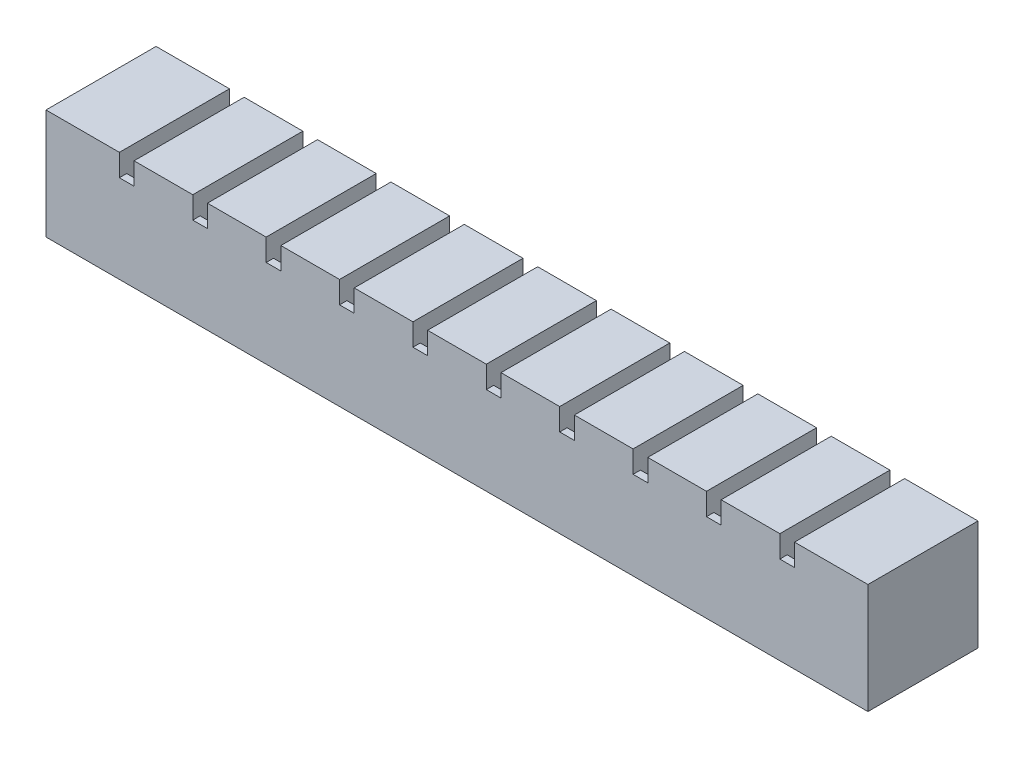
from build123d import *

# Parameters (mm, degrees)
SKETCH1_W                       = 8
SKETCH1_H                       = 15
FIRST_CHAMBER_BLOCK_DEPTH       = 15
SKETCH2_W                       = 6
SKETCH2_H                       = 11
FIRST_CHAMBER_CAVITY_DEPTH      = 13
SKETCH3_W                       = 15
SKETCH3_H                       = 3
CHAMBER_SPACER_DEPTH            = 2
PATTERN_CHAMBERS_COUNT          = 11
PATTERN_CHAMBERS_PITCH          = 10
SKETCH4_W                       = 15
SKETCH4_H                       = 12
THICKEN_END_1_DEPTH             = 2
SKETCH5_W                       = 15
SKETCH5_H                       = 15
THICKEN_END_2_DEPTH             = 2
SKETCH6_W                       = 94
SKETCH6_H                       = 2
CENTRAL_AIR_CHANNEL_DEPTH       = 2
SKETCH7_W                       = 108
SKETCH7_H                       = 13
SKETCH7_W_2                     = 106
SKETCH7_H_2                     = 11
BONDING_RIDGE_DEPTH             = 2
SKETCH9_W                       = 2
SKETCH9_H                       = 2.5
BONDING_BUMPS_DEPTH             = 2
PATTERN_BONDING_BUMPS_COUNT     = 10
PATTERN_BONDING_BUMPS_PITCH     = 10
SKIZZE1_W                       = 112
SKIZZE1_H                       = 15
SCHNITT_LINEAR_AUSTRAGEN1_DEPTH = 113.026782512
SKIZZE2_W                       = 2
SKIZZE2_H                       = 1
AUFSATZ_LINEAR_AUSTRAGEN1_DEPTH = 9
LINEARES_MUSTER1_COUNT          = 10
LINEARES_MUSTER1_PITCH          = 10
SKIZZE4_R                       = 1.25
SCHNITT_LINEAR_AUSTRAGEN3_DEPTH = 112.776562839


with BuildPart() as part:
    # Sketch1 → first chamber block (new body)
    with BuildSketch(Plane.XY):
        with Locations((4, 7.5)):
            Rectangle(SKETCH1_W, SKETCH1_H)
    extrude(amount=FIRST_CHAMBER_BLOCK_DEPTH)

    # Sketch2 → first chamber cavity (cut)
    with BuildSketch(Plane.XZ):
        with Locations((4, 7.5)):
            Rectangle(SKETCH2_W, SKETCH2_H)
    extrude(amount=-FIRST_CHAMBER_CAVITY_DEPTH, mode=Mode.SUBTRACT)

    # Sketch3 → chamber spacer (add)
    with BuildSketch(Plane(origin=(8, 0, 0), x_dir=(0, 0, -1), z_dir=(1, 0, 0))):
        with Locations((-7.5, 1.5)):
            Rectangle(SKETCH3_W, SKETCH3_H)
    extrude(amount=CHAMBER_SPACER_DEPTH)


with BuildPart() as pattern_chambers_1:
    # pattern chambers: pattern copy
    add(part.part.moved(Location(Vector(1, 0, 0) * (1 * PATTERN_CHAMBERS_PITCH))))


with BuildPart() as pattern_chambers_2:
    # pattern chambers: pattern copy
    add(part.part.moved(Location(Vector(1, 0, 0) * (2 * PATTERN_CHAMBERS_PITCH))))


with BuildPart() as pattern_chambers_3:
    # pattern chambers: pattern copy
    add(part.part.moved(Location(Vector(1, 0, 0) * (3 * PATTERN_CHAMBERS_PITCH))))


with BuildPart() as pattern_chambers_4:
    # pattern chambers: pattern copy
    add(part.part.moved(Location(Vector(1, 0, 0) * (4 * PATTERN_CHAMBERS_PITCH))))


with BuildPart() as pattern_chambers_5:
    # pattern chambers: pattern copy
    add(part.part.moved(Location(Vector(1, 0, 0) * (5 * PATTERN_CHAMBERS_PITCH))))


with BuildPart() as pattern_chambers_6:
    # pattern chambers: pattern copy
    add(part.part.moved(Location(Vector(1, 0, 0) * (6 * PATTERN_CHAMBERS_PITCH))))


with BuildPart() as pattern_chambers_7:
    # pattern chambers: pattern copy
    add(part.part.moved(Location(Vector(1, 0, 0) * (7 * PATTERN_CHAMBERS_PITCH))))


with BuildPart() as pattern_chambers_8:
    # pattern chambers: pattern copy
    add(part.part.moved(Location(Vector(1, 0, 0) * (8 * PATTERN_CHAMBERS_PITCH))))


with BuildPart() as pattern_chambers_9:
    # pattern chambers: pattern copy
    add(part.part.moved(Location(Vector(1, 0, 0) * (9 * PATTERN_CHAMBERS_PITCH))))


with BuildPart() as pattern_chambers_10:
    # pattern chambers: pattern copy
    add(part.part.moved(Location(Vector(1, 0, 0) * (10 * PATTERN_CHAMBERS_PITCH))))

    # combine into 1 solid body: union pattern chambers_9, pattern chambers_8, pattern chambers_7, pattern chambers_6, pattern chambers_5, pattern chambers_4, pattern chambers_3, pattern chambers_2, pattern chambers_1, part
    add(pattern_chambers_9.part)
    add(pattern_chambers_8.part)
    add(pattern_chambers_7.part)
    add(pattern_chambers_6.part)
    add(pattern_chambers_5.part)
    add(pattern_chambers_4.part)
    add(pattern_chambers_3.part)
    add(pattern_chambers_2.part)
    add(pattern_chambers_1.part)
    add(part.part)

    # Sketch4 → thicken end 1 (add)
    with BuildSketch(Plane(origin=(108, 0, 0), x_dir=(0, 0, -1), z_dir=(1, 0, 0))):
        with Locations((-7.5, 9)):
            Rectangle(SKETCH4_W, SKETCH4_H)
    extrude(amount=THICKEN_END_1_DEPTH)

    # Sketch5 → thicken end 2 (add)
    with BuildSketch(Plane.ZY):
        with Locations((7.5, 7.5)):
            Rectangle(SKETCH5_W, SKETCH5_H)
    extrude(amount=THICKEN_END_2_DEPTH)

    # Sketch6 → central air channel (cut)
    with BuildSketch(Plane.XZ):
        with Locations((54, 7.5)):
            Rectangle(SKETCH6_W, SKETCH6_H)
    extrude(amount=-CENTRAL_AIR_CHANNEL_DEPTH, mode=Mode.SUBTRACT)

    # Sketch7 → bonding ridge (add)
    with BuildSketch(Plane.XZ):
        with Locations((54, 7.5)):
            Rectangle(SKETCH7_W, SKETCH7_H)
        with Locations((54, 7.5)):
            Rectangle(SKETCH7_W_2, SKETCH7_H_2, mode=Mode.SUBTRACT)
    extrude(amount=BONDING_RIDGE_DEPTH)

    # Sketch9 → bonding bumps (add)
    with BuildSketch(Plane.XZ):
        with Locations((9, 10.75)):
            Rectangle(SKETCH9_W, SKETCH9_H)
        with Locations((9, 4.25)):
            Rectangle(SKETCH9_W, SKETCH9_H)
    bonding_bumps = extrude(amount=BONDING_BUMPS_DEPTH)

    # pattern bonding bumps: bonding bumps ×10
    with Locations(*[(i * PATTERN_BONDING_BUMPS_PITCH, 0, 0) for i in range(1, PATTERN_BONDING_BUMPS_COUNT)]):
        add(bonding_bumps)

    # Skizze1 → Schnitt-Linear austragen1 (cut, through all)
    with BuildSketch(Plane.XZ):
        with Locations((54, 7.5)):
            Rectangle(SKIZZE1_W, SKIZZE1_H)
    extrude(amount=SCHNITT_LINEAR_AUSTRAGEN1_DEPTH, mode=Mode.SUBTRACT)

    # Skizze2 → Aufsatz-Linear austragen1 (add)
    with BuildSketch(Plane(origin=(0, 3, 0), x_dir=(1, 0, 0), z_dir=(0, 1, 0))):
        with Locations((99, -0.5)):
            Rectangle(SKIZZE2_W, SKIZZE2_H)
        with Locations((99, -14.5)):
            Rectangle(SKIZZE2_W, SKIZZE2_H)
    aufsatz_linear_austragen1 = extrude(amount=AUFSATZ_LINEAR_AUSTRAGEN1_DEPTH)

    # Lineares Muster1: Aufsatz-Linear austragen1 ×10
    with Locations(*[(-i * LINEARES_MUSTER1_PITCH, 0, 0) for i in range(1, LINEARES_MUSTER1_COUNT)]):
        add(aufsatz_linear_austragen1)

    # Skizze4 → Schnitt-Linear austragen3 (cut, through all)
    with BuildSketch(Plane.XY.offset(2)):
        with Locations((4, 6.5)):
            Circle(SKIZZE4_R)
    extrude(amount=-SCHNITT_LINEAR_AUSTRAGEN3_DEPTH, mode=Mode.SUBTRACT)


solid = pattern_chambers_10.part
